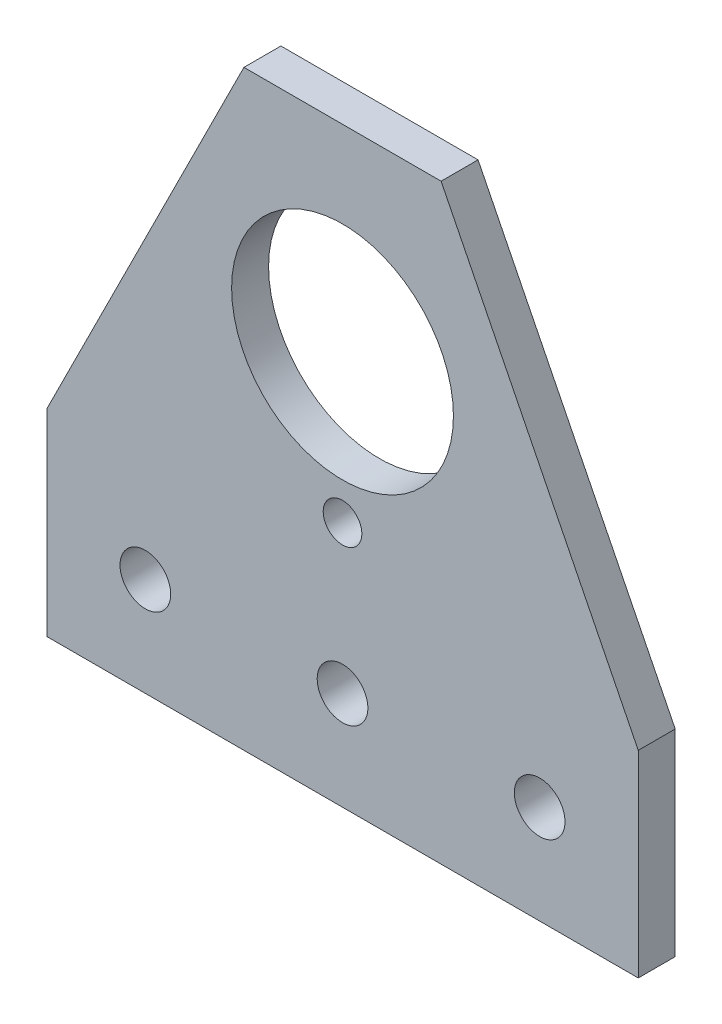
from build123d import *

# Parameters (mm, degrees)
SKETCH1_R           = 3.2639
SKETCH1_R_2         = 14.2875
SKETCH1_R_3         = 2.4892
BOSS_EXTRUDE1_DEPTH = 4.7625


with BuildPart() as part:
    # Sketch1 → Boss-Extrude1 (new body)
    with BuildSketch(Plane.XY):
        Polygon((0, 0), (76.2, 0), (76.2, 25.4), (50.8, 76.2), (25.4, 76.2), (0, 25.4), align=None)
        with Locations(Location((38.1, 12.7, 0), (0, 0, 180))):
            Circle(SKETCH1_R, mode=Mode.SUBTRACT)
        with Locations(Location((63.5, 12.7, 0), (0, 0, 180))):
            Circle(SKETCH1_R, mode=Mode.SUBTRACT)
        with Locations(Location((12.7, 12.7, 0), (0, 0, 180))):
            Circle(SKETCH1_R, mode=Mode.SUBTRACT)
        with Locations(Location((38.1, 50.8, 0), (0, 0, 180))):
            Circle(SKETCH1_R_2, mode=Mode.SUBTRACT)
        with Locations(Location((38.1, 31.75, 0), (0, 0, 180))):
            Circle(SKETCH1_R_3, mode=Mode.SUBTRACT)
    extrude(amount=BOSS_EXTRUDE1_DEPTH)


solid = part.part
